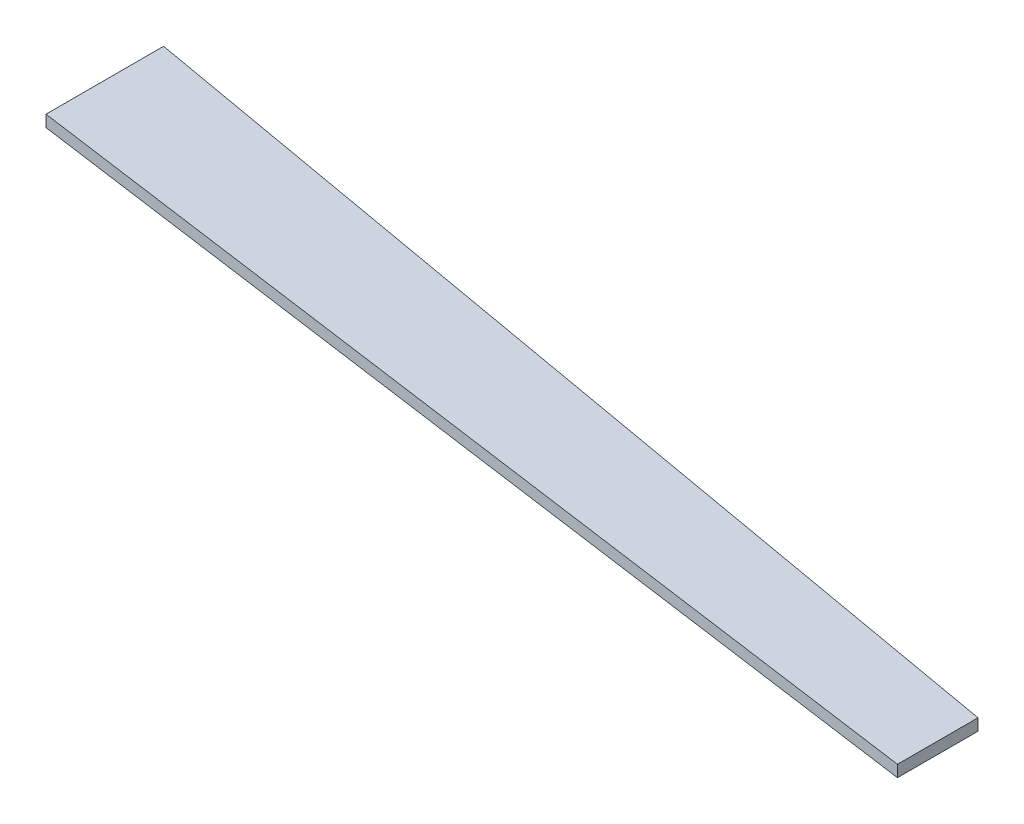
from build123d import *

# Parameters (mm, degrees)
BOSS_EXTRUDE1_DEPTH = 2


with BuildPart() as part:
    # Sketch1 → Boss-Extrude1 (new body)
    with BuildSketch(Plane(origin=(0, 0, 0), x_dir=(1, 0, 0), z_dir=(0, 1, 0))):
        Polygon((-65.491262136, 13.247961165), (-65.491262136, 33.467961165), (104.506252189, 3.492812736), (104.506252189, -10.357187264), align=None)
    extrude(amount=BOSS_EXTRUDE1_DEPTH)


solid = part.part
